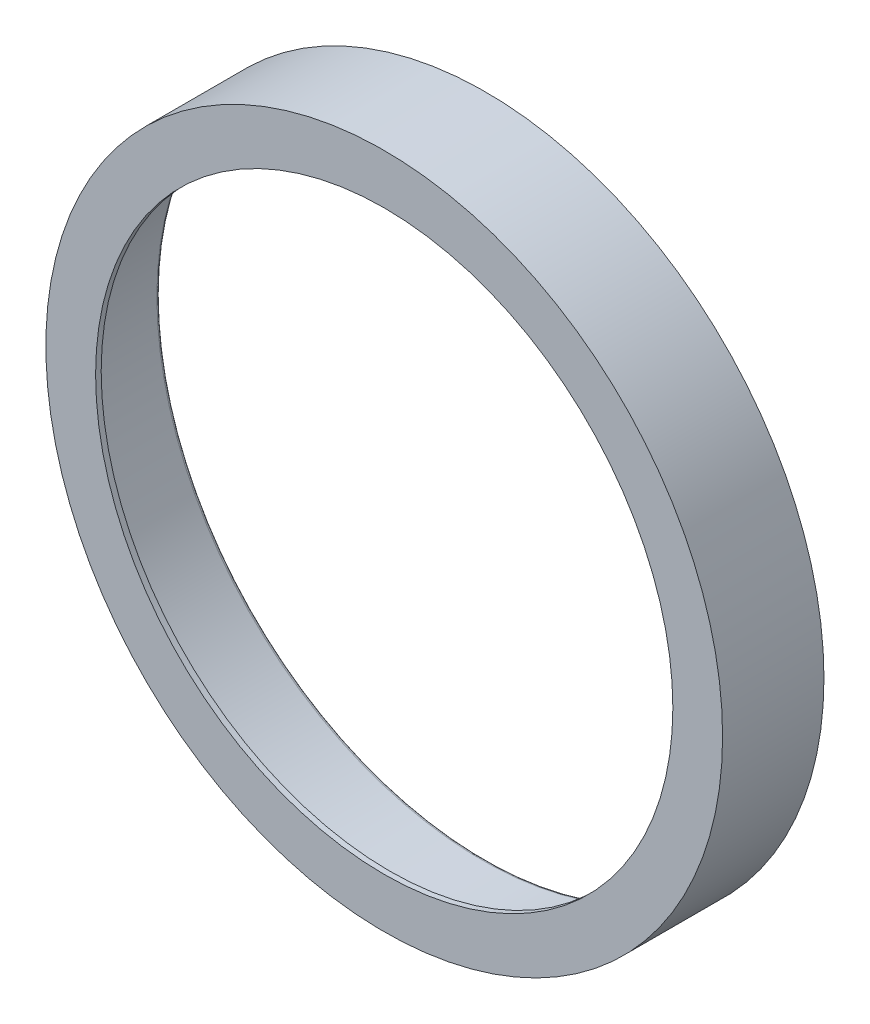
from build123d import *

# Parameters (mm, degrees)
BASEPLATE_R         = 106
BASEPLATE_R_2       = 90.414349638
BOSS_EXTRUDE1_DEPTH = 31.75
SKETCH2_R           = 101.971973166
CUT_EXTRUDE1_DEPTH  = 30
FILLET1_R           = 1
FILLET2_R           = 1


with BuildPart() as part:
    # Baseplate → Boss-Extrude1 (new body)
    with BuildSketch(Plane.XY):
        Circle(BASEPLATE_R)
        Circle(BASEPLATE_R_2, mode=Mode.SUBTRACT)
    extrude(amount=BOSS_EXTRUDE1_DEPTH)

    # Sketch2 → Cut-Extrude1 (cut)
    with BuildSketch(Plane(origin=(0, 0, 0), x_dir=(-1, 0, 0), z_dir=(0, 0, -1))):
        Circle(SKETCH2_R)
    extrude(amount=-CUT_EXTRUDE1_DEPTH, mode=Mode.SUBTRACT)

    # Fillet1
    fillet1_edges = [part.edges().sort_by_distance(p)[0] for p in [
        (101.971973166, 0, 0),
    ]]
    fillet(fillet1_edges, radius=FILLET1_R)

    # Fillet2
    fillet2_edges = [part.edges().sort_by_distance(p)[0] for p in [
        (101.971973166, 0, 30),
    ]]
    fillet(fillet2_edges, radius=FILLET2_R)


solid = part.part
